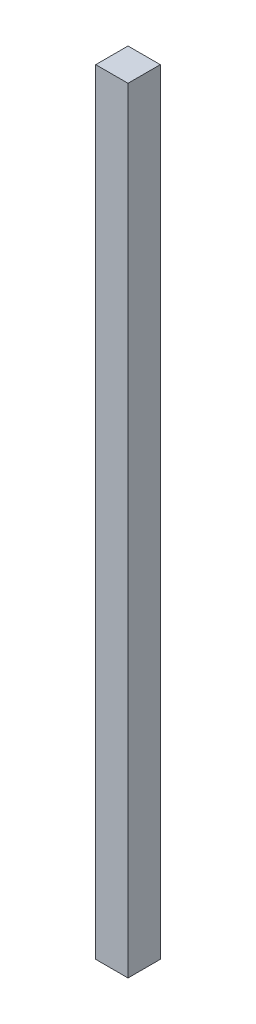
from build123d import *

# Parameters (mm, degrees)
SKETCH1_W           = 25.4
SKETCH1_H           = 25.4
BOSS_EXTRUDE1_DEPTH = 609.6


with BuildPart() as part:
    # Sketch1 → Boss-Extrude1 (new body)
    with BuildSketch(Plane(origin=(0, 0, 0), x_dir=(1, 0, 0), z_dir=(0, 1, 0))):
        with Locations((12.7, 12.7)):
            Rectangle(SKETCH1_W, SKETCH1_H)
    extrude(amount=BOSS_EXTRUDE1_DEPTH)


solid = part.part
